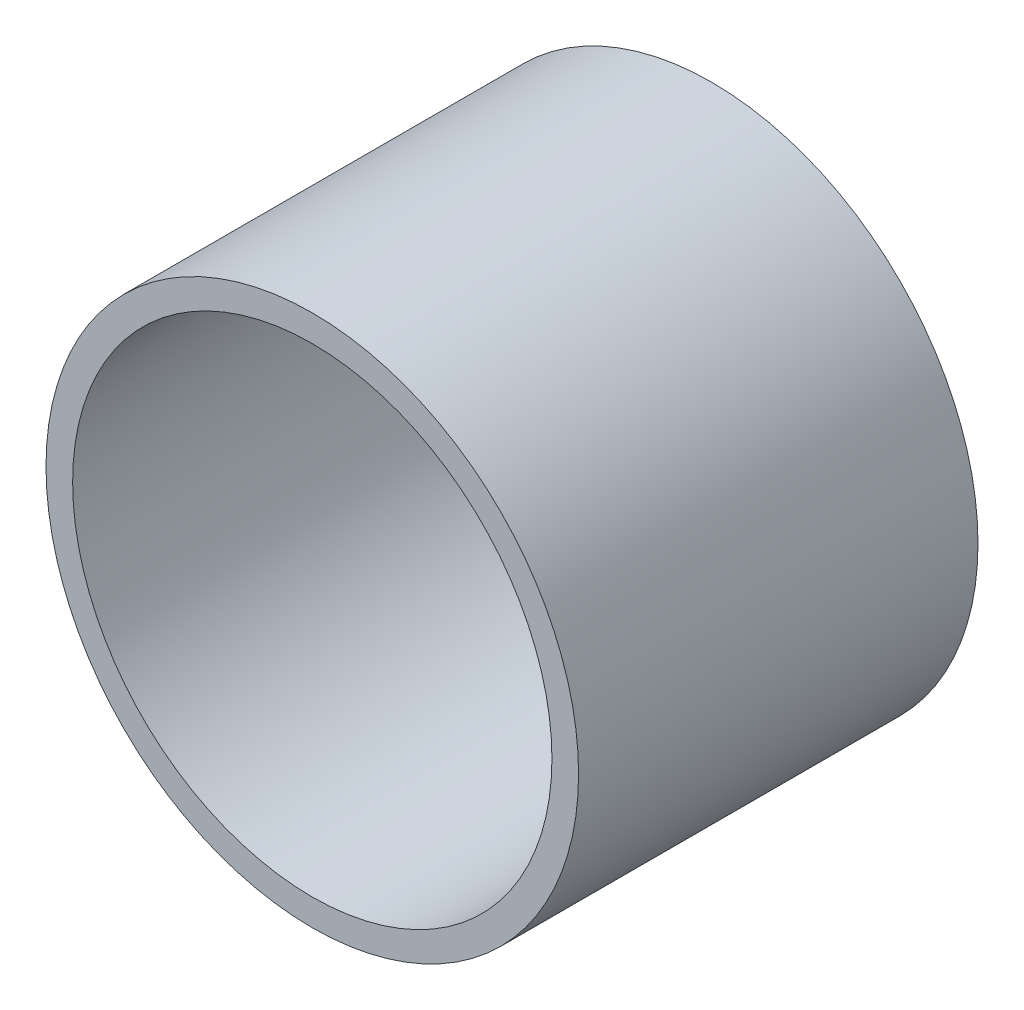
from build123d import *

# Parameters (mm, degrees)
SKETCH_1_R          = 20
EXTRUDE_1_DEPTH     = 30
SKETCH_2_R          = 18
CUT_EXTRUDE_1_DEPTH = 42.231056256


with BuildPart() as part:
    # Эскиз1 → Бобышка-Вытянуть1 (new body)
    with BuildSketch(Plane.XY):
        Circle(SKETCH_1_R)
    extrude(amount=EXTRUDE_1_DEPTH)

    # Эскиз2 → Вырез-Вытянуть1 (cut, through all)
    with BuildSketch(Plane.XY.offset(30)):
        Circle(SKETCH_2_R)
    extrude(amount=-CUT_EXTRUDE_1_DEPTH, mode=Mode.SUBTRACT)


solid = part.part
